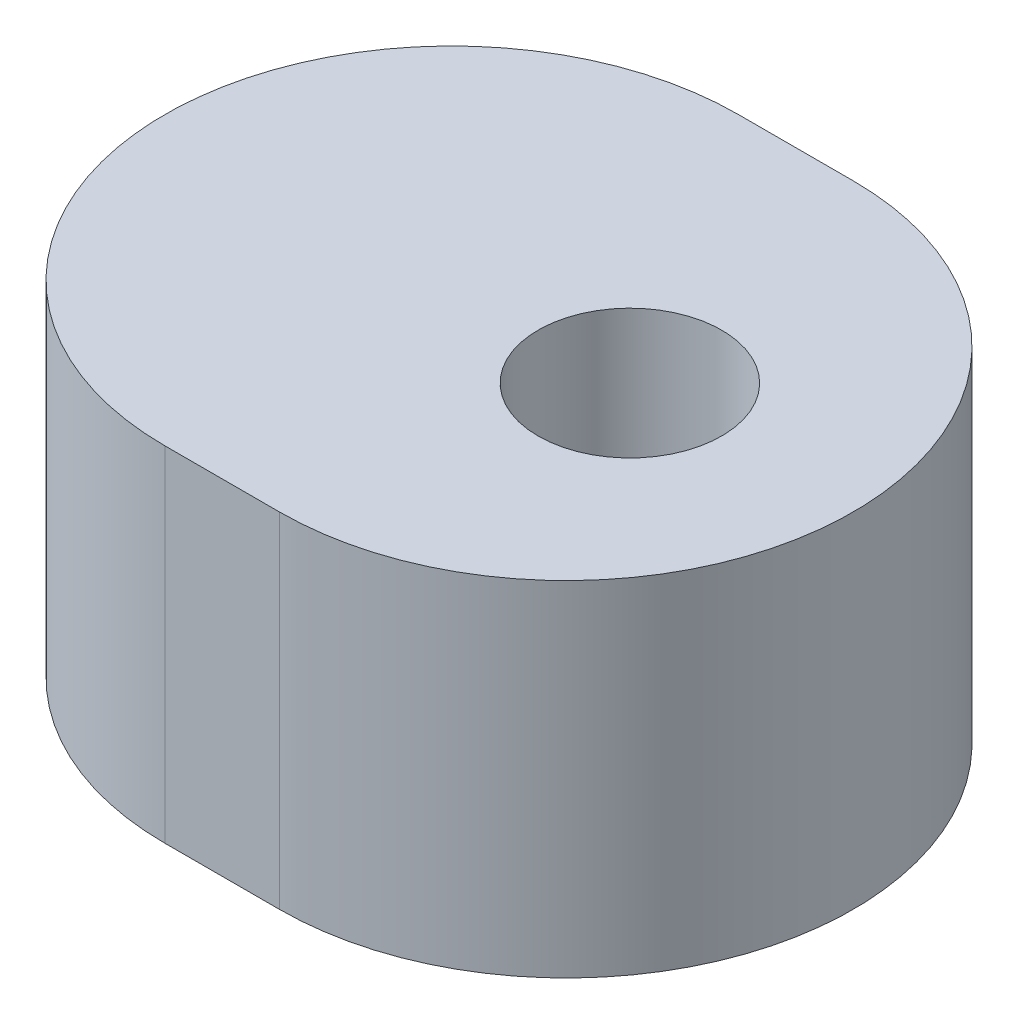
from build123d import *

# Parameters (mm, degrees)
ESBO_O1_R                = 1.6
RESSALTO_EXTRUS_O1_DEPTH = 6


with BuildPart() as part:
    # Esboço1 → Ressalto-extrusão1 (new body)
    with BuildSketch(Plane.XZ.offset(18)):
        with BuildLine():
            Line((-3.107348146, -5), (-1.107348146, -5))
            ThreePointArc((-1.107348146, -5), (3.892651854, 0), (-1.107348146, 5))
            Line((-1.107348146, 5), (-3.107348146, 5))
            ThreePointArc((-3.107348146, 5), (-8.107348146, 0), (-3.107348146, -5))
        make_face()
        with Locations(Location((0, 0, 0), (0, 0, 90))):
            Circle(ESBO_O1_R, mode=Mode.SUBTRACT)
    extrude(amount=-RESSALTO_EXTRUS_O1_DEPTH)


solid = part.part
